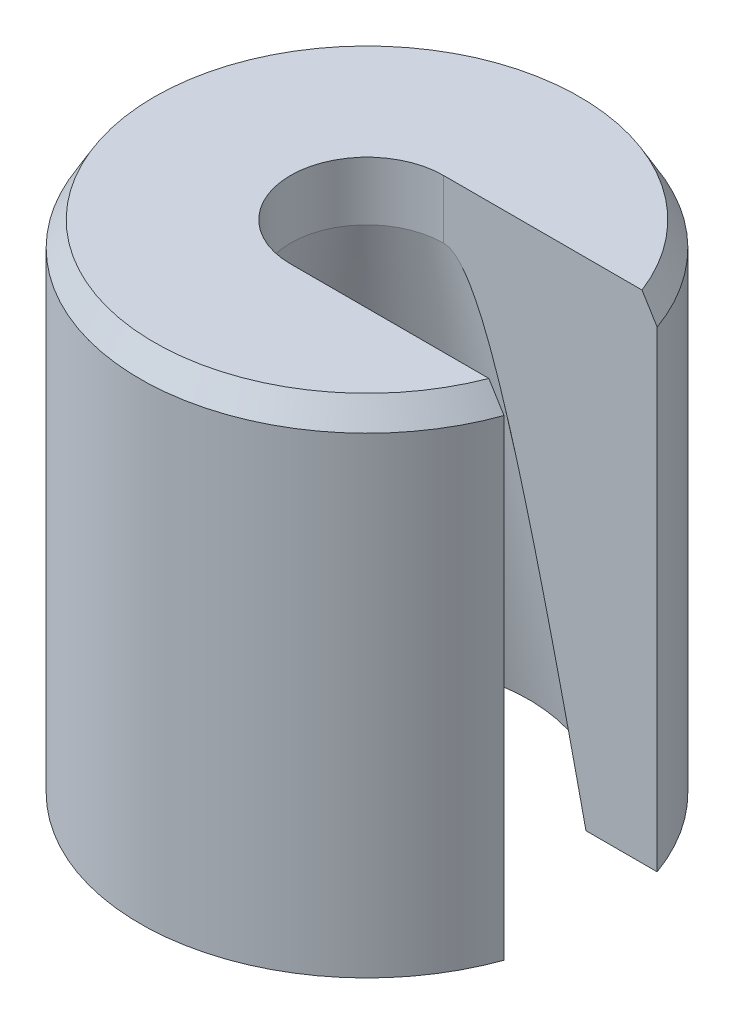
from build123d import *

# Parameters (mm, degrees)
SKETCH1_R           = 8
SKETCH1_R_2         = 2.7
BOSS_EXTRUDE1_DEPTH = 17.5
CHAMFER1_SIZE       = 3
CHAMFER1_SIZE2      = 15.433662048
CHAMFER2_SIZE       = 0.5
CHAMFER2_SIZE2      = 0.866025404
SKETCH2_W           = 11.3806618
SKETCH2_H           = 5.4
CUT_EXTRUDE1_DEPTH  = 20


with BuildPart() as part:
    # Sketch1 → Boss-Extrude1 (new body)
    with BuildSketch(Plane(origin=(0, 0, 0), x_dir=(1, 0, 0), z_dir=(0, 1, 0))):
        with Locations(Location((0, 0, 0), (0, 0, 270))):
            Circle(SKETCH1_R)
        with Locations(Location((0, 0, 0), (0, 0, 270))):
            Circle(SKETCH1_R_2, mode=Mode.SUBTRACT)
    extrude(amount=BOSS_EXTRUDE1_DEPTH)

    # Chamfer1
    chamfer1_edges = [part.edges().sort_by_distance(p)[0] for p in [
        (0, 0, -2.7),
    ]]
    chamfer1_side = [part.faces().sort_by_distance(p)[0] for p in [
        (0, 0, -7.77372583),
    ]]
    chamfer(chamfer1_edges, length=CHAMFER1_SIZE, length2=CHAMFER1_SIZE2, reference=chamfer1_side[0])

    # Chamfer2
    chamfer2_edges = [part.edges().sort_by_distance(p)[0] for p in [
        (0, 17.5, -8),
    ]]
    chamfer2_side = [part.faces().sort_by_distance(p)[0] for p in [
        (0, 17.5, -7.77372583),
    ]]
    chamfer(chamfer2_edges, length=CHAMFER2_SIZE, length2=CHAMFER2_SIZE2, reference=chamfer2_side[0])

    # Sketch2 → Cut-Extrude1 (cut)
    with BuildSketch(Plane(origin=(0, 17.5, 0), x_dir=(1, 0, 0), z_dir=(0, 1, 0))):
        with Locations((5.6903309, 0)):
            Rectangle(SKETCH2_W, SKETCH2_H)
    extrude(amount=-CUT_EXTRUDE1_DEPTH, mode=Mode.SUBTRACT)


solid = part.part
